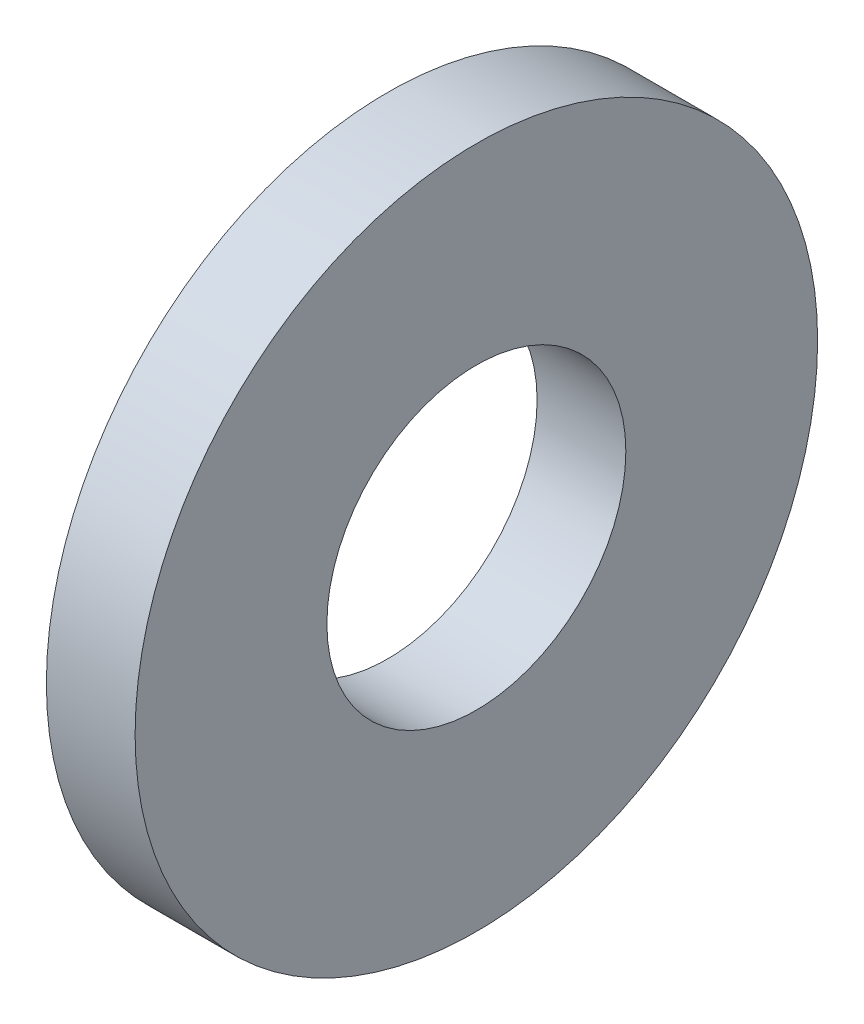
from build123d import *

# Parameters (mm, degrees)
SKETCH1_R           = 6.35
SKETCH1_R_2         = 2.7813
BOSS_EXTRUDE1_DEPTH = 1.651


with BuildPart() as part:
    # Sketch1 → Boss-Extrude1 (new body)
    with BuildSketch(Plane(origin=(0, 0, 0), x_dir=(0, 0, -1), z_dir=(1, 0, 0))):
        with Locations(Location((0, 0, 0), (0, 0, 180))):
            Circle(SKETCH1_R)
        with Locations(Location((0, 0, 0), (0, 0, 180))):
            Circle(SKETCH1_R_2, mode=Mode.SUBTRACT)
    extrude(amount=BOSS_EXTRUDE1_DEPTH)


solid = part.part
